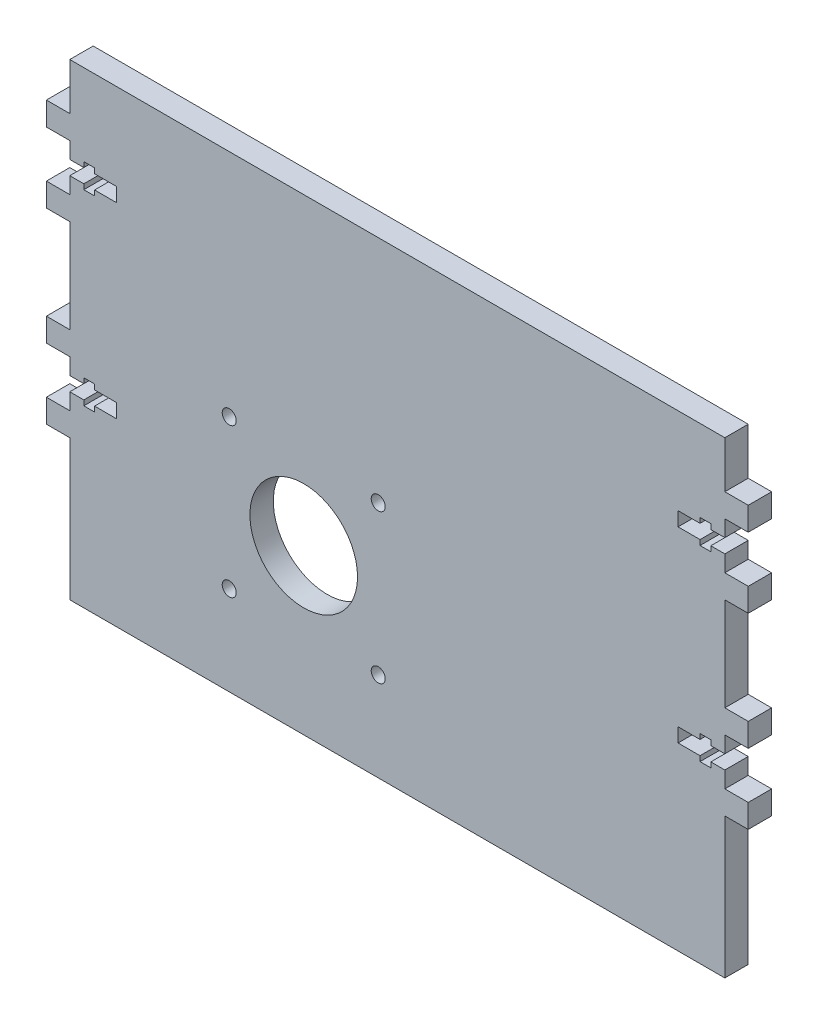
from build123d import *

# Parameters (mm, degrees)
SKETCH1_R           = 1.5
SKETCH1_R_2         = 11.5
BOSS_EXTRUDE1_DEPTH = 5


with BuildPart() as part:
    # Sketch1 → Boss-Extrude1 (new body)
    with BuildSketch(Plane.XY):
        Polygon((0, 100), (-140, 100), (-140, 90), (-145, 90), (-145, 85), (-140, 85), (-140, 81.5), (-137, 81.5), (-137, 82.6), (-134.7, 82.6), (-134.7, 81.5), (-130, 81.5), (-130, 78.5), (-134.7, 78.5), (-134.7, 77.4), (-137, 77.4), (-137, 78.5), (-140, 78.5), (-140, 75), (-145, 75), (-145, 70), (-140, 70), (-140, 50), (-145, 50), (-145, 45), (-140, 45), (-140, 41.5), (-137, 41.5), (-137, 42.6), (-134.7, 42.6), (-134.7, 41.5), (-130, 41.5), (-130, 38.5), (-134.7, 38.5), (-134.7, 37.4), (-137, 37.4), (-137, 38.5), (-140, 38.5), (-140, 35), (-145, 35), (-145, 30), (-140, 30), (-140, 0), (0, 0), (0, 30), (5, 30), (5, 35), (0, 35), (0, 38.5), (-3, 38.5), (-3, 37.4), (-5.3, 37.4), (-5.3, 38.5), (-10, 38.5), (-10, 41.5), (-5.3, 41.5), (-5.3, 42.6), (-3, 42.6), (-3, 41.5), (0, 41.5), (0, 45), (5, 45), (5, 50), (0, 50), (0, 70), (5, 70), (5, 75), (0, 75), (0, 78.5), (-3, 78.5), (-3, 77.4), (-5.3, 77.4), (-5.3, 78.5), (-10, 78.5), (-10, 81.5), (-5.3, 81.5), (-5.3, 82.6), (-3, 82.6), (-3, 81.5), (0, 81.5), (0, 85), (5, 85), (5, 90), (0, 90), align=None)
        with Locations((-105.922, 50.922)):
            Circle(SKETCH1_R, mode=Mode.SUBTRACT)
        with Locations((-74.078, 50.922)):
            Circle(SKETCH1_R, mode=Mode.SUBTRACT)
        with Locations((-74.078, 19.078)):
            Circle(SKETCH1_R, mode=Mode.SUBTRACT)
        with Locations((-105.922, 19.078)):
            Circle(SKETCH1_R, mode=Mode.SUBTRACT)
        with Locations((-90, 35)):
            Circle(SKETCH1_R_2, mode=Mode.SUBTRACT)
    extrude(amount=BOSS_EXTRUDE1_DEPTH)


solid = part.part
